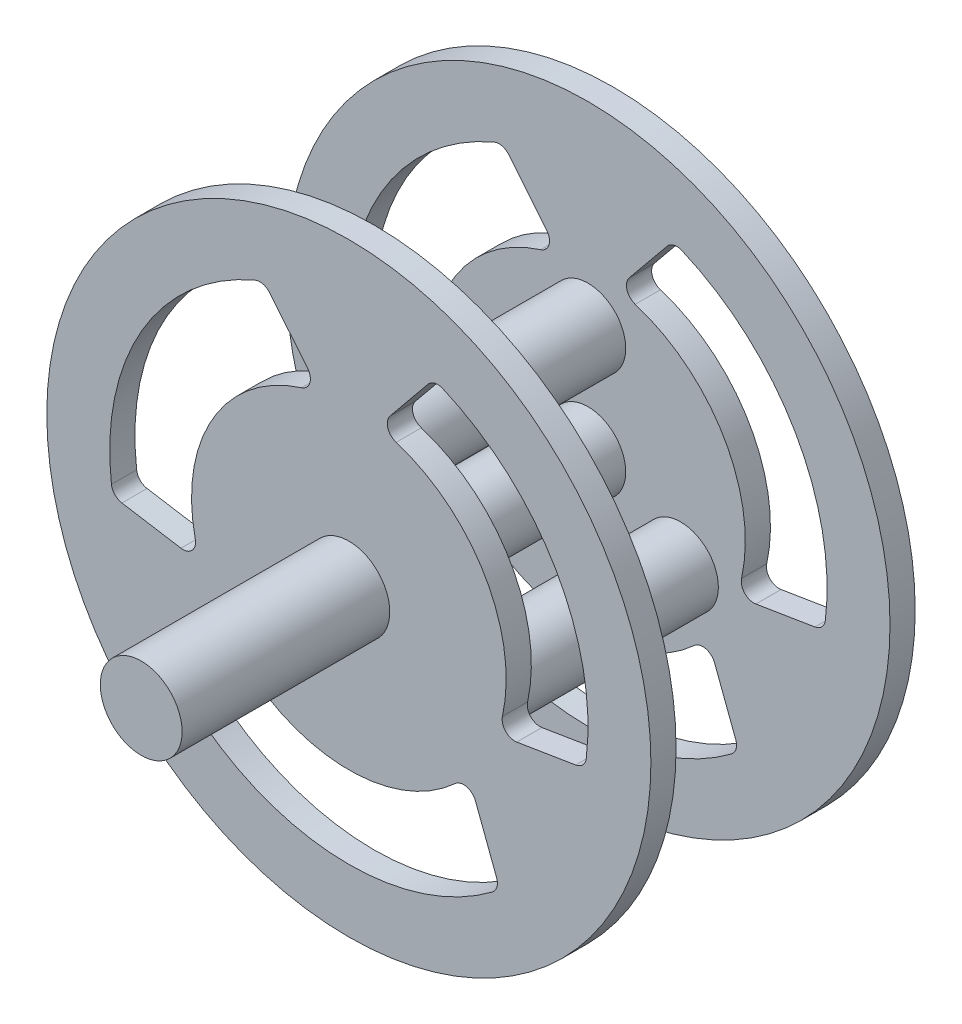
from build123d import *

# Parameters (mm, degrees)
SKETCH_1_R      = 24
EXTRUDE_1_DEPTH = 2
SKETCH_2_R      = 3
EXTRUDE_2_DEPTH = 17
SKETCH_3_R      = 24
EXTRUDE_3_DEPTH = 2
SKETCH_4_R      = 3.25
EXTRUDE_4_DEPTH = 16.5


with BuildPart() as part:
    # 草图1 → 凸台-拉伸1 (new body)
    with BuildSketch(Plane.XY):
        Circle(SKETCH_1_R)
        with BuildLine():
            Line((-11.739632055, -14.042831804), (-10.057601798, -9.597641998))
            ThreePointArc((-10.057601798, -9.597641998), (-9.353754198, -8.978695741), (-8.446592755, -9.214394762))
            ThreePointArc((-8.446592755, -9.214394762), (0, -12.5), (8.446592755, -9.214394762))
            ThreePointArc((8.446592755, -9.214394762), (9.353754198, -8.978695741), (10.057601798, -9.597641998))
            Line((10.057601798, -9.597641998), (11.739632055, -14.042831804))
            ThreePointArc((11.739632055, -14.042831804), (11.764677024, -14.675613965), (11.404592123, -15.196554824))
            ThreePointArc((11.404592123, -15.196554824), (0, -19), (-11.404592123, -15.196554824))
            ThreePointArc((-11.404592123, -15.196554824), (-11.764677024, -14.675613965), (-11.739632055, -14.042831804))
        make_face(mode=Mode.SUBTRACT)
        with BuildLine():
            Line((-18.03126511, -3.145403689), (-13.340602686, -3.91131766))
            ThreePointArc((-13.340602686, -3.91131766), (-12.452655704, -3.611240886), (-12.203196322, -2.70776652))
            ThreePointArc((-12.203196322, -2.70776652), (-10.825317547, 6.25), (-3.756603567, 11.922161282))
            ThreePointArc((-3.756603567, 11.922161282), (-3.098901506, 12.589936627), (-3.283000887, 13.508959657))
            Line((-3.283000887, 13.508959657), (-6.291633055, 17.188235493))
            ThreePointArc((-6.291633055, 17.188235493), (-6.827115998, 17.526316153), (-7.458306466, 17.47494391))
            ThreePointArc((-7.458306466, 17.47494391), (-16.454482672, 9.5), (-18.862898589, -2.278389086))
            ThreePointArc((-18.862898589, -2.278389086), (-18.591793022, -2.850702188), (-18.03126511, -3.145403689))
        make_face(mode=Mode.SUBTRACT)
        with BuildLine():
            Line((6.291633055, 17.188235493), (3.283000887, 13.508959657))
            ThreePointArc((3.283000887, 13.508959657), (3.098901506, 12.589936627), (3.756603567, 11.922161282))
            ThreePointArc((3.756603567, 11.922161282), (10.825317547, 6.25), (12.203196322, -2.70776652))
            ThreePointArc((12.203196322, -2.70776652), (12.452655704, -3.611240886), (13.340602686, -3.91131766))
            Line((13.340602686, -3.91131766), (18.03126511, -3.145403689))
            ThreePointArc((18.03126511, -3.145403689), (18.591793022, -2.850702188), (18.862898589, -2.278389086))
            ThreePointArc((18.862898589, -2.278389086), (16.454482672, 9.5), (7.458306466, 17.47494391))
            ThreePointArc((7.458306466, 17.47494391), (6.827115998, 17.526316153), (6.291633055, 17.188235493))
        make_face(mode=Mode.SUBTRACT)
    extrude(amount=EXTRUDE_1_DEPTH)

    # 草图2 → 凸台-拉伸2 (add)
    with BuildSketch(Plane.XY.offset(2)):
        Circle(SKETCH_2_R)
        with Locations((0, 8.5)):
            Circle(SKETCH_2_R)
        with Locations((7.361215932, -4.25)):
            Circle(SKETCH_2_R)
        with Locations((-7.361215932, -4.25)):
            Circle(SKETCH_2_R)
    extrude(amount=EXTRUDE_2_DEPTH)

    # 草图3 → 凸台-拉伸3 (add)
    with BuildSketch(Plane.XY.offset(19)):
        Circle(SKETCH_3_R)
        with BuildLine():
            Line((-10.057601798, -9.597641998), (-11.739632055, -14.042831804))
            ThreePointArc((-11.739632055, -14.042831804), (-11.764677024, -14.675613965), (-11.404592123, -15.196554824))
            ThreePointArc((-11.404592123, -15.196554824), (0, -19), (11.404592123, -15.196554824))
            ThreePointArc((11.404592123, -15.196554824), (11.764677024, -14.675613965), (11.739632055, -14.042831804))
            Line((11.739632055, -14.042831804), (10.057601798, -9.597641998))
            ThreePointArc((10.057601798, -9.597641998), (9.353754198, -8.978695741), (8.446592755, -9.214394762))
            ThreePointArc((8.446592755, -9.214394762), (0, -12.5), (-8.446592755, -9.214394762))
            ThreePointArc((-8.446592755, -9.214394762), (-9.353754198, -8.978695741), (-10.057601798, -9.597641998))
        make_face(mode=Mode.SUBTRACT)
        with BuildLine():
            Line((6.291633055, 17.188235493), (3.283000887, 13.508959657))
            ThreePointArc((3.283000887, 13.508959657), (3.098901506, 12.589936627), (3.756603567, 11.922161282))
            ThreePointArc((3.756603567, 11.922161282), (10.825317547, 6.25), (12.203196322, -2.70776652))
            ThreePointArc((12.203196322, -2.70776652), (12.452655704, -3.611240886), (13.340602686, -3.91131766))
            Line((13.340602686, -3.91131766), (18.03126511, -3.145403689))
            ThreePointArc((18.03126511, -3.145403689), (18.591793022, -2.850702188), (18.862898589, -2.278389086))
            ThreePointArc((18.862898589, -2.278389086), (16.454482672, 9.5), (7.458306466, 17.47494391))
            ThreePointArc((7.458306466, 17.47494391), (6.827115998, 17.526316153), (6.291633055, 17.188235493))
        make_face(mode=Mode.SUBTRACT)
        with BuildLine():
            Line((-3.283000887, 13.508959657), (-6.291633055, 17.188235493))
            ThreePointArc((-6.291633055, 17.188235493), (-6.827115998, 17.526316153), (-7.458306466, 17.47494391))
            ThreePointArc((-7.458306466, 17.47494391), (-16.454482672, 9.5), (-18.862898589, -2.278389086))
            ThreePointArc((-18.862898589, -2.278389086), (-18.591793022, -2.850702188), (-18.03126511, -3.145403689))
            Line((-18.03126511, -3.145403689), (-13.340602686, -3.91131766))
            ThreePointArc((-13.340602686, -3.91131766), (-12.452655704, -3.611240886), (-12.203196322, -2.70776652))
            ThreePointArc((-12.203196322, -2.70776652), (-10.825317547, 6.25), (-3.756603567, 11.922161282))
            ThreePointArc((-3.756603567, 11.922161282), (-3.098901506, 12.589936627), (-3.283000887, 13.508959657))
        make_face(mode=Mode.SUBTRACT)
    extrude(amount=EXTRUDE_3_DEPTH)

    # 草图4 → 凸台-拉伸4 (add)
    with BuildSketch(Plane.XY.offset(21)):
        Circle(SKETCH_4_R)
    extrude(amount=EXTRUDE_4_DEPTH)


solid = part.part
